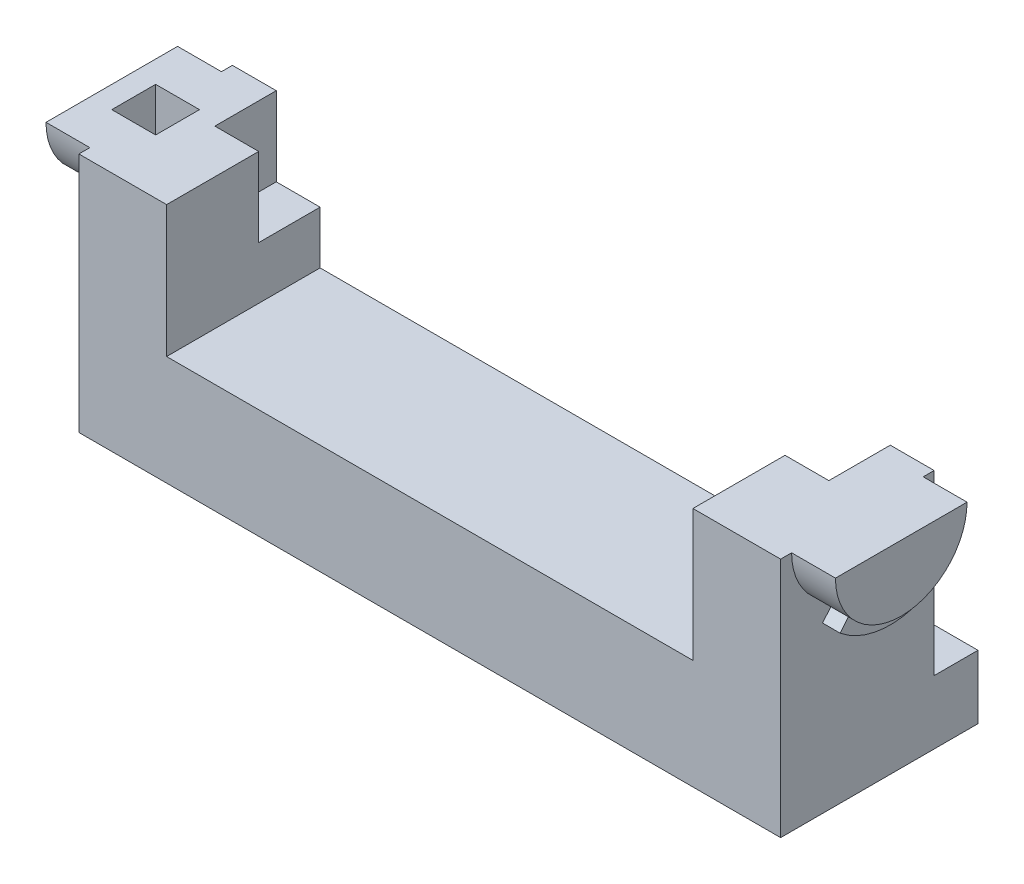
from build123d import *

# Parameters (mm, degrees)
SKETCH1_W           = 40.64
SKETCH1_H           = 6.35
BOSS_EXTRUDE1_DEPTH = 8.89
SKETCH2_W           = 5.08
SKETCH2_H           = 8.89
BOSS_EXTRUDE2_DEPTH = 7.62
SKETCH3_W           = 5.08
SKETCH3_H           = 8.89
BOSS_EXTRUDE3_DEPTH = 7.62
SKETCH4_W           = 3.556
SKETCH4_H           = 4.572
CUT_EXTRUDE1_DEPTH  = 2.54
BOSS_EXTRUDE4_DEPTH = 2.54
SKETCH6_W           = 40.64
SKETCH6_H           = 3.683
BOSS_EXTRUDE5_DEPTH = 2.54
SKETCH7_W           = 3.556
SKETCH7_H           = 3.556
CUT_EXTRUDE2_DEPTH  = 2.54
BOSS_EXTRUDE6_START = 2.54
BOSS_EXTRUDE6_DEPTH = 2.54
WRAP1_SECTION_W     = 0.762
WRAP1_SECTION_H     = 1.016
WRAP1_ANGLE         = 76.394372684
SKETCH11_W          = 0.508
SKETCH11_H          = 6.35
CUT_EXTRUDE3_DEPTH  = 1.27
SKETCH12_W          = 2.54
SKETCH12_H          = 2.54
CUT_EXTRUDE4_DEPTH  = 2.54


with BuildPart() as part:
    # Sketch1 → Boss-Extrude1 (new body)
    with BuildSketch(Plane.XY):
        with Locations((20.32, 3.175)):
            Rectangle(SKETCH1_W, SKETCH1_H)
    extrude(amount=BOSS_EXTRUDE1_DEPTH)

    # Sketch2 → Boss-Extrude2 (add)
    with BuildSketch(Plane(origin=(0, 6.35, 0), x_dir=(1, 0, 0), z_dir=(0, 1, 0))):
        with Locations((2.54, -4.445)):
            Rectangle(SKETCH2_W, SKETCH2_H)
    extrude(amount=BOSS_EXTRUDE2_DEPTH)

    # Sketch3 → Boss-Extrude3 (add)
    with BuildSketch(Plane(origin=(0, 6.35, 0), x_dir=(1, 0, 0), z_dir=(0, 1, 0))):
        with Locations((38.1, -4.445)):
            Rectangle(SKETCH3_W, SKETCH3_H)
    extrude(amount=BOSS_EXTRUDE3_DEPTH)

    # Sketch4 → Cut-Extrude1 (cut)
    with BuildSketch(Plane(origin=(5.08, 0, 0), x_dir=(0, 0, -1), z_dir=(1, 0, 0))):
        with Locations((-1.778, 11.684)):
            Rectangle(SKETCH4_W, SKETCH4_H)
    extrude(amount=-CUT_EXTRUDE1_DEPTH, mode=Mode.SUBTRACT)

    # Sketch5 → Boss-Extrude4 (add)
    with BuildSketch(Plane.ZY):
        with BuildLine():
            Line((8.255, 13.97), (0.635, 13.97))
            ThreePointArc((0.635, 13.97), (4.445, 10.16), (8.255, 13.97))
        make_face()
    extrude(amount=BOSS_EXTRUDE4_DEPTH)

    # Sketch6 → Boss-Extrude5 (add)
    with BuildSketch(Plane(origin=(0, 0, 0), x_dir=(-1, 0, 0), z_dir=(0, 0, -1))):
        with Locations((-20.32, 1.8415)):
            Rectangle(SKETCH6_W, SKETCH6_H)
    extrude(amount=BOSS_EXTRUDE5_DEPTH)

    # Sketch7 → Cut-Extrude2 (cut)
    with BuildSketch(Plane.ZY.offset(-35.56)):
        with Locations((1.778, 12.192)):
            Rectangle(SKETCH7_W, SKETCH7_H)
    extrude(amount=-CUT_EXTRUDE2_DEPTH, mode=Mode.SUBTRACT)

    # Sketch8 → Boss-Extrude6 (add)
    with BuildSketch(Plane(origin=(40.64, 0, 0), x_dir=(0, 0, -1), z_dir=(1, 0, 0)).offset(BOSS_EXTRUDE6_START)):
        with BuildLine():
            Line((-0.635, 13.97), (-8.255, 13.97))
            ThreePointArc((-8.255, 13.97), (-4.445, 10.16), (-0.635, 13.97))
        make_face()
    extrude(amount=-BOSS_EXTRUDE6_DEPTH)

    # Wrap1 section (on wrap section) → Wrap1 (revolve)
    with BuildSketch(Plane(origin=(43.18, 13.97, 4.445), x_dir=(0, -0.772203868534924, 0.6353748385163658), z_dir=(0, 0.6353748385163658, 0.772203868534924))):
        with Locations((4.191, -1.143)):
            Rectangle(WRAP1_SECTION_W, WRAP1_SECTION_H)
    revolve(axis=Axis((43.18, 13.97, 4.445), (1, 0, 0)), revolution_arc=WRAP1_ANGLE)

    # Sketch11 → Cut-Extrude3 (cut)
    with BuildSketch(Plane.XZ):
        with Locations((20.32, 0.635)):
            Rectangle(SKETCH11_W, SKETCH11_H)
    extrude(amount=-CUT_EXTRUDE3_DEPTH, mode=Mode.SUBTRACT)

    # Sketch12 → Cut-Extrude4 (cut)
    with BuildSketch(Plane(origin=(0, 13.97, 0), x_dir=(1, 0, 0), z_dir=(0, 1, 0))):
        with Locations((0, -4.445)):
            Rectangle(SKETCH12_W, SKETCH12_H)
    extrude(amount=-CUT_EXTRUDE4_DEPTH, mode=Mode.SUBTRACT)


solid = part.part
